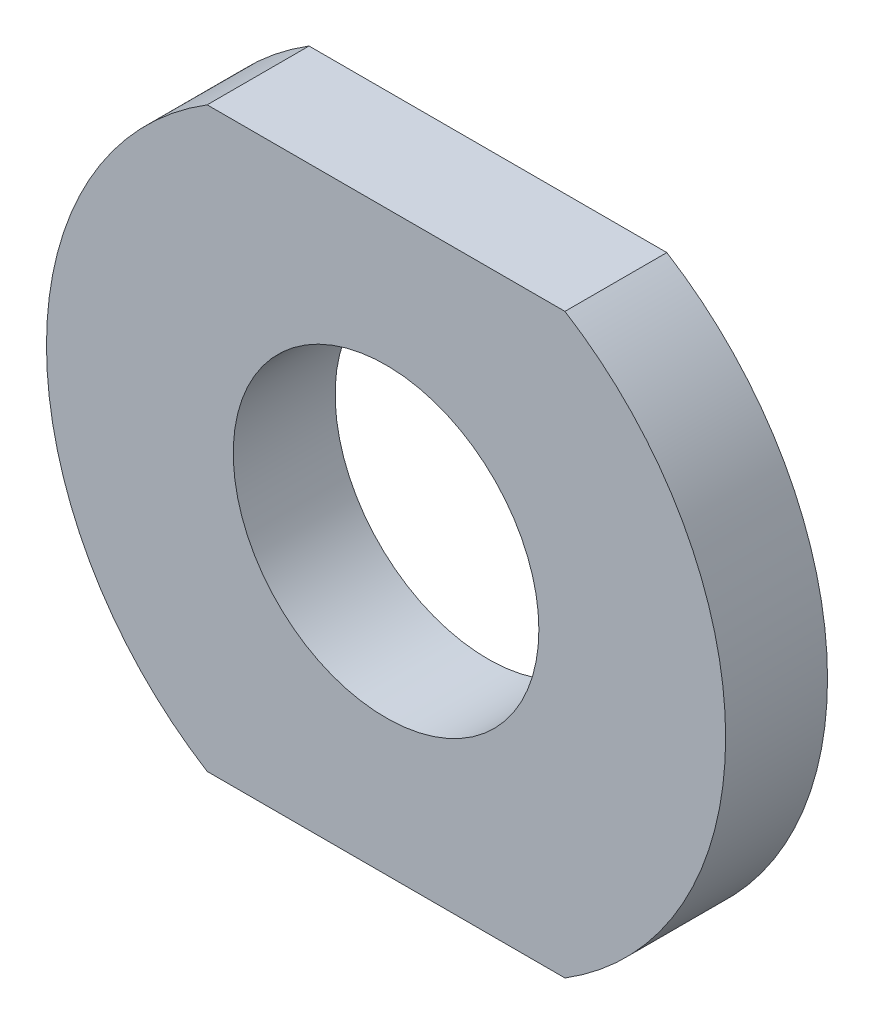
from build123d import *

# Parameters (mm, degrees)
SKETCH_1_R      = 4.5
EXTRUDE_1_DEPTH = 3


with BuildPart() as part:
    # 草图1 → 凸台-拉伸1 (new body)
    with BuildSketch(Plane.XY):
        with BuildLine():
            Line((-5.267826876, 8.5), (5.267826876, 8.5))
            ThreePointArc((5.267826876, 8.5), (10, 0), (5.267826876, -8.5))
            Line((5.267826876, -8.5), (-5.267826876, -8.5))
            ThreePointArc((-5.267826876, -8.5), (-10, 0), (-5.267826876, 8.5))
        make_face()
        Circle(SKETCH_1_R, mode=Mode.SUBTRACT)
    extrude(amount=EXTRUDE_1_DEPTH)


solid = part.part
